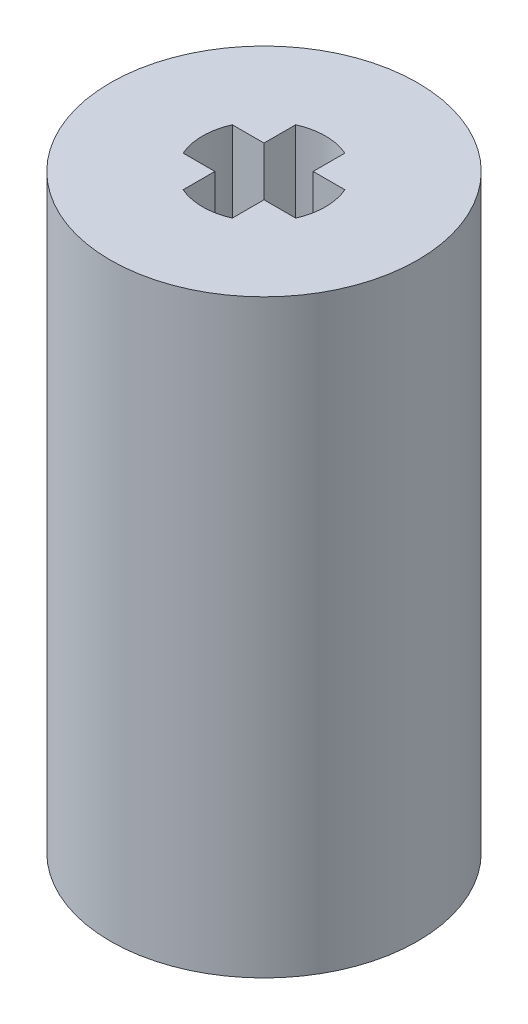
from build123d import *

# Parameters (mm, degrees)
ESQUISSE1_R             = 6.25
BOSS_EXTRU_1_DEPTH      = 24
ENL_V_MAT_EXTRU_1_DEPTH = 12
ESQUISSE5_W             = 2
ESQUISSE5_H             = 2
ENL_V_MAT_EXTRU_3_DEPTH = 10


with BuildPart() as part:
    # Esquisse1 → Boss.-Extru.1 (new body)
    with BuildSketch(Plane(origin=(0, 0, 0), x_dir=(1, 0, 0), z_dir=(0, 1, 0))):
        with Locations(Location((0, 0, 0), (0, 0, 270))):
            Circle(ESQUISSE1_R)
    extrude(amount=BOSS_EXTRU_1_DEPTH)

    # Esquisse4 → Enlèv. mat.-Extru.1 (cut)
    with BuildSketch(Plane.XZ):
        with BuildLine():
            Line((1.671638418, 3.075), (1.671638418, -3.075))
            ThreePointArc((1.671638418, -3.075), (-3.5, 0), (1.671638418, 3.075))
        make_face()
    extrude(amount=-ENL_V_MAT_EXTRU_1_DEPTH, mode=Mode.SUBTRACT)

    # Esquisse5 → Enlèv. mat.-Extru.3 (cut)
    with BuildSketch(Plane(origin=(0, 24, 0), x_dir=(1, 0, 0), z_dir=(0, 1, 0))):
        with BuildLine():
            Line((-1, 1), (1, 1))
            Line((1, 1), (1, 2.291287847))
            ThreePointArc((1, 2.291287847), (0, 2.5), (-1, 2.291287847))
            Line((-1, 2.291287847), (-1, 1))
        make_face()
        with BuildLine():
            Line((1, 1), (1, -1))
            Line((1, -1), (2.291287847, -1))
            ThreePointArc((2.291287847, -1), (2.5, 0), (2.291287847, 1))
            Line((2.291287847, 1), (1, 1))
        make_face()
        with BuildLine():
            Line((-2.291287847, -1), (-1, -1))
            Line((-1, -1), (-1, 1))
            Line((-1, 1), (-2.291287847, 1))
            ThreePointArc((-2.291287847, 1), (-2.5, 0), (-2.291287847, -1))
        make_face()
        with BuildLine():
            ThreePointArc((-1, -2.291287847), (0, -2.5), (1, -2.291287847))
            Line((1, -2.291287847), (1, -1))
            Line((1, -1), (-1, -1))
            Line((-1, -1), (-1, -2.291287847))
        make_face()
        Rectangle(ESQUISSE5_W, ESQUISSE5_H)
    extrude(amount=-ENL_V_MAT_EXTRU_3_DEPTH, mode=Mode.SUBTRACT)


solid = part.part
